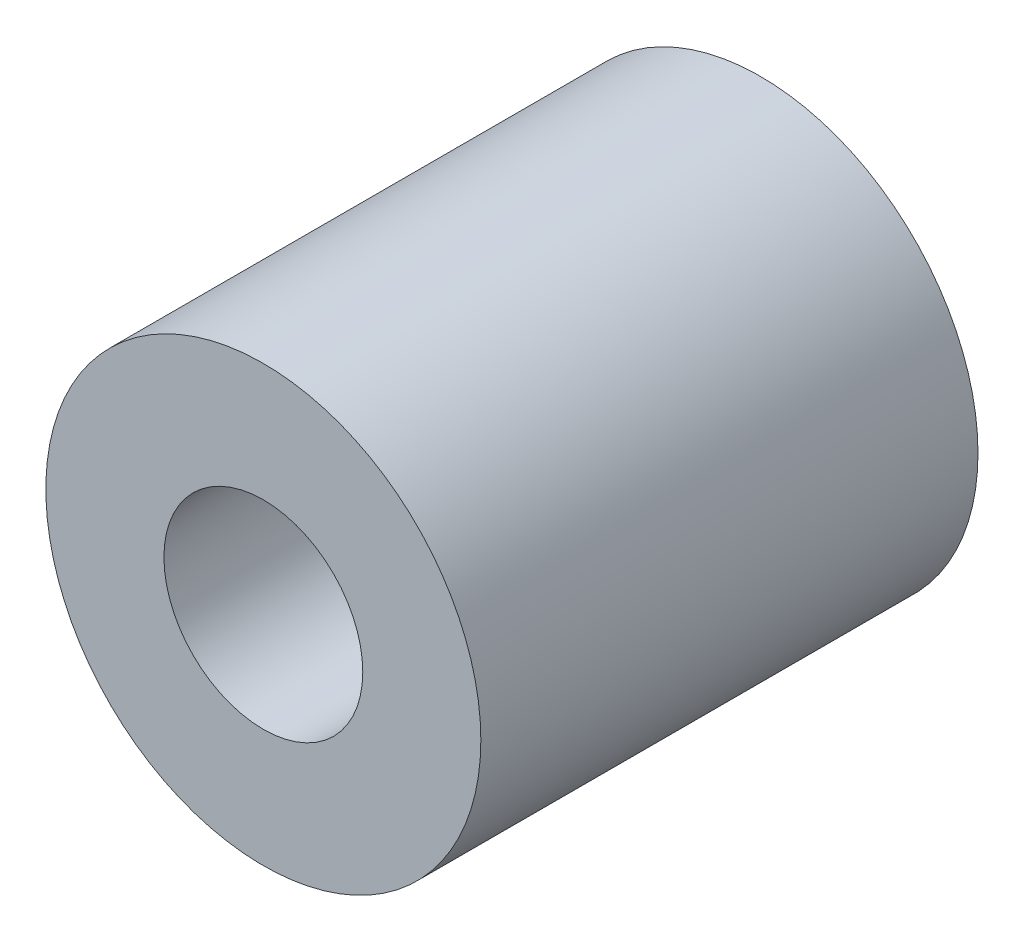
from build123d import *

# Parameters (mm, degrees)
SKETCH_1_R      = 3.5
SKETCH_1_R_2    = 1.6
EXTRUDE_1_DEPTH = 8


with BuildPart() as part:
    # ｽｹｯﾁ1 → ﾎﾞｽ - 押し出し1 (new body)
    with BuildSketch(Plane.XY):
        Circle(SKETCH_1_R)
        Circle(SKETCH_1_R_2, mode=Mode.SUBTRACT)
    extrude(amount=EXTRUDE_1_DEPTH)


solid = part.part
